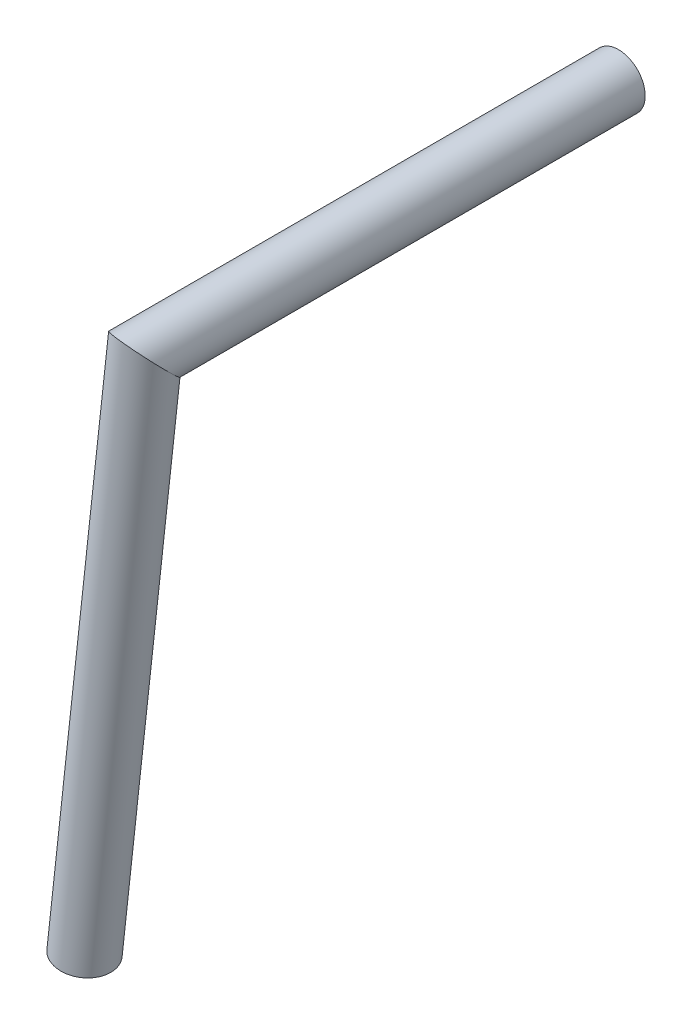
from build123d import *

# Parameters (mm, degrees)
SKETCH1_R = 2.983609071


with BuildPart() as part:
    # Sweep3: sweep along a curve in space
    with BuildLine() as sweep3_path:
        Line((0, 0, 0), (0, 0, 52.924484134))
        Line((0, 0, 52.924484134), (-7.494028266, -62.061306362, 52.104689201))
    # Sketch1 → Sweep3 (sweep)
    with BuildSketch(Plane.XY):
        Circle(SKETCH1_R)
    sweep(path=sweep3_path.line, transition=Transition.RIGHT)


solid = part.part
